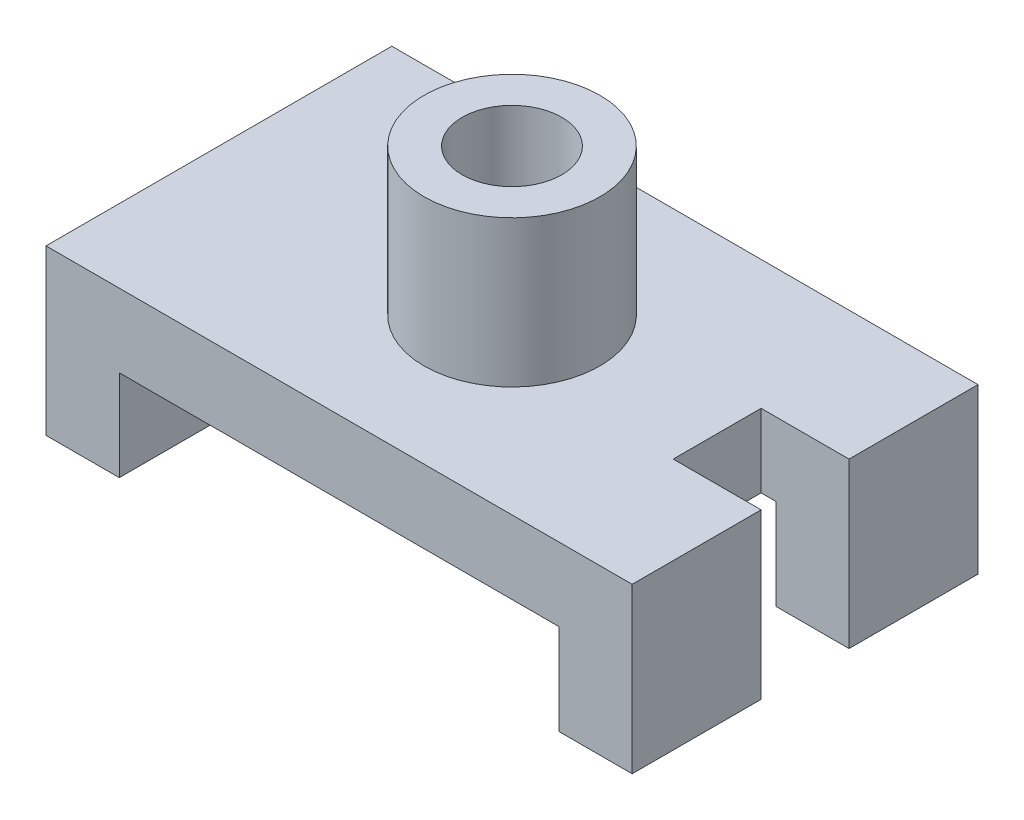
from build123d import *

# Parameters (mm, degrees)
SALIENTE_EXTRUIR1_DEPTH = 2.36
CROQUIS2_W              = 0.6
CROQUIS2_H              = 0.6
CORTAR_EXTRUIR2_DEPTH   = 4.289984802
CROQUIS3_R              = 0.6
CROQUIS3_R_2            = 0.34
SALIENTE_EXTRUIR2_DEPTH = 1


with BuildPart() as part:
    # Croquis1 → Saliente-Extruir1 (new body)
    with BuildSketch(Plane.XY):
        Polygon((1.5, -0.62), (2, -0.62), (2, 0.5), (-2, 0.5), (-2, -0.62), (-1.5, -0.62), (-1.5, 0), (1.5, 0), align=None)
    extrude(amount=-SALIENTE_EXTRUIR1_DEPTH)

    # Croquis2 → Cortar-Extruir2 (cut, through all)
    with BuildSketch(Plane(origin=(0, 0.5, 0), x_dir=(1, 0, 0), z_dir=(0, 1, 0))):
        with Locations((1.7, 1.18)):
            Rectangle(CROQUIS2_W, CROQUIS2_H)
    extrude(amount=-CORTAR_EXTRUIR2_DEPTH, mode=Mode.SUBTRACT)

    # Croquis3 → Saliente-Extruir2 (add)
    with BuildSketch(Plane(origin=(0, 0.5, 0), x_dir=(1, 0, 0), z_dir=(0, 1, 0))):
        with Locations(Location((0, 1.18, 0), (0, 0, 270))):
            Circle(CROQUIS3_R)
        with Locations(Location((0, 1.18, 0), (0, 0, 270))):
            Circle(CROQUIS3_R_2, mode=Mode.SUBTRACT)
    extrude(amount=SALIENTE_EXTRUIR2_DEPTH)


solid = part.part
